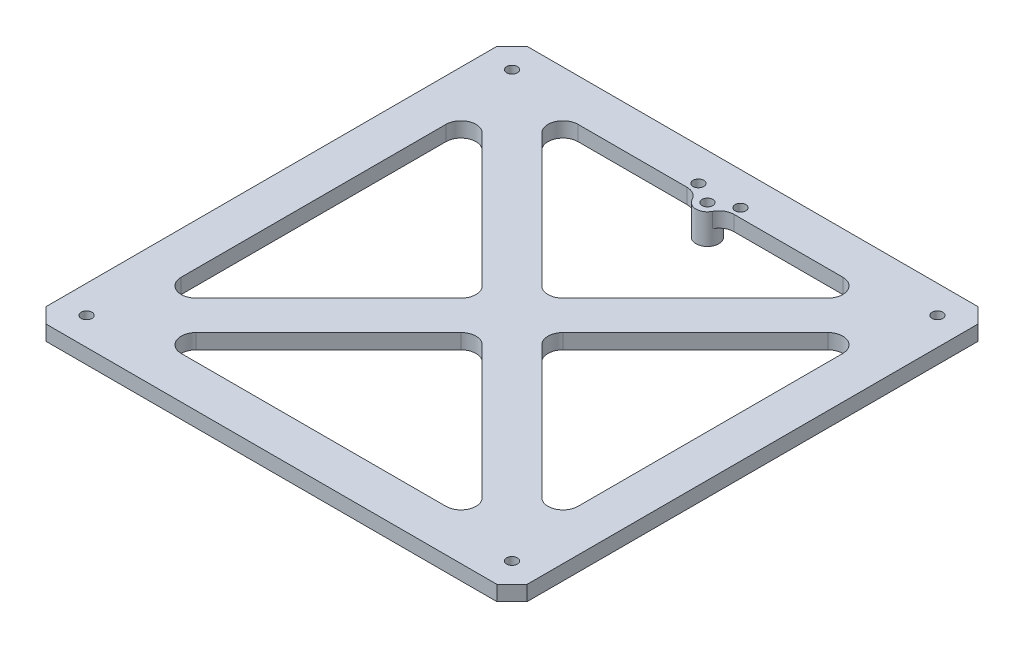
from build123d import *

# Parameters (mm, degrees)
BOSS_EXTRUDE1_DEPTH = 6.35
CUT_EXTRUDE1_DEPTH  = 288.438345563
SKETCH3_R           = 2.286
CUT_EXTRUDE2_DEPTH  = 288.438345563
BOSS_EXTRUDE2_DEPTH = 6.35
SKETCH5_R           = 4.826
BOSS_EXTRUDE3_DEPTH = 6.35
SKETCH6_R           = 2.286
CUT_EXTRUDE3_DEPTH  = 288.648691984


with BuildPart() as part:
    # Sketch1 → Boss-Extrude1 (new body)
    with BuildSketch(Plane(origin=(0, 0, 0), x_dir=(1, 0, 0), z_dir=(0, 1, 0))):
        Polygon((0, 196.85), (6.35, 203.2), (196.85, 203.2), (203.2, 196.85), (203.2, 6.35), (196.85, 0), (6.35, 0), (0, 6.35), align=None)
    extrude(amount=BOSS_EXTRUDE1_DEPTH)

    # Sketch2 → Cut-Extrude1 (cut, through all)
    with BuildSketch(Plane(origin=(0, 6.35, 0), x_dir=(1, 0, 0), z_dir=(0, 1, 0))):
        with BuildLine():
            Line((45.682614691, 185.42), (157.517385309, 185.42))
            ThreePointArc((157.517385309, 185.42), (163.384020341, 181.500039796), (162.00751337, 174.579871939))
            Line((162.00751337, 174.579871939), (106.090128061, 118.66248663))
            ThreePointArc((106.090128061, 118.66248663), (101.6, 116.802614691), (97.109871939, 118.66248663))
            Line((97.109871939, 118.66248663), (41.19248663, 174.579871939))
            ThreePointArc((41.19248663, 174.579871939), (39.815979659, 181.500039796), (45.682614691, 185.42))
        make_face()
        with BuildLine():
            Line((17.78, 157.517385309), (17.78, 45.682614691))
            ThreePointArc((17.78, 45.682614691), (21.699960204, 39.815979659), (28.620128061, 41.19248663))
            Line((28.620128061, 41.19248663), (84.53751337, 97.109871939))
            ThreePointArc((84.53751337, 97.109871939), (86.397385309, 101.6), (84.53751337, 106.090128061))
            Line((84.53751337, 106.090128061), (28.620128061, 162.00751337))
            ThreePointArc((28.620128061, 162.00751337), (21.699960204, 163.384020341), (17.78, 157.517385309))
        make_face()
        with BuildLine():
            Line((45.682614691, 17.78), (157.517385309, 17.78))
            ThreePointArc((157.517385309, 17.78), (163.384020341, 21.699960204), (162.00751337, 28.620128061))
            Line((162.00751337, 28.620128061), (106.090128061, 84.53751337))
            ThreePointArc((106.090128061, 84.53751337), (101.6, 86.397385309), (97.109871939, 84.53751337))
            Line((97.109871939, 84.53751337), (41.19248663, 28.620128061))
            ThreePointArc((41.19248663, 28.620128061), (39.815979659, 21.699960204), (45.682614691, 17.78))
        make_face()
        with BuildLine():
            Line((185.42, 157.517385309), (185.42, 45.682614691))
            ThreePointArc((185.42, 45.682614691), (181.500039796, 39.815979659), (174.579871939, 41.19248663))
            Line((174.579871939, 41.19248663), (118.66248663, 97.109871939))
            ThreePointArc((118.66248663, 97.109871939), (116.802614691, 101.6), (118.66248663, 106.090128061))
            Line((118.66248663, 106.090128061), (174.579871939, 162.00751337))
            ThreePointArc((174.579871939, 162.00751337), (181.500039796, 163.384020341), (185.42, 157.517385309))
        make_face()
    extrude(amount=-CUT_EXTRUDE1_DEPTH, mode=Mode.SUBTRACT)

    # Sketch3 → Cut-Extrude2 (cut, through all)
    with BuildSketch(Plane(origin=(0, 6.35, 0), x_dir=(1, 0, 0), z_dir=(0, 1, 0))):
        with Locations(Location((11.73734, 11.73734, 0), (0, 0, 270))):
            Circle(SKETCH3_R)
        with Locations(Location((191.46266, 11.73734, 0), (0, 0, 270))):
            Circle(SKETCH3_R)
        with Locations(Location((191.46266, 191.46266, 0), (0, 0, 270))):
            Circle(SKETCH3_R)
        with Locations(Location((11.73734, 191.46266, 0), (0, 0, 270))):
            Circle(SKETCH3_R)
    extrude(amount=-CUT_EXTRUDE2_DEPTH, mode=Mode.SUBTRACT)

    # Sketch4 → Boss-Extrude2 (add)
    with BuildSketch(Plane(origin=(0, 6.35, 0), x_dir=(1, 0, 0), z_dir=(0, 1, 0))):
        with BuildLine():
            Line((111.554726315, 185.42), (91.645273685, 185.42))
            ThreePointArc((91.645273685, 185.42), (94.961453031, 184.485298195), (97.301368182, 181.956363636))
            ThreePointArc((97.301368182, 181.956363636), (101.6, 179.324), (105.898631818, 181.956363636))
            ThreePointArc((105.898631818, 181.956363636), (108.238546969, 184.485298195), (111.554726315, 185.42))
        make_face()
    extrude(amount=-BOSS_EXTRUDE2_DEPTH)

    # Sketch5 → Boss-Extrude3 (add)
    with BuildSketch(Plane.XZ):
        with Locations(Location((101.6, -184.15, 0), (0, 0, 152.964308211))):
            Circle(SKETCH5_R)
    extrude(amount=BOSS_EXTRUDE3_DEPTH)

    # Sketch6 → Cut-Extrude3 (cut, through all)
    with BuildSketch(Plane.XZ.offset(6.35)):
        with Locations(Location((101.6, -184.15, 0), (0, 0, 270))):
            Circle(SKETCH6_R)
        with Locations(Location((92.71, -189.23, 0), (0, 0, 270))):
            Circle(SKETCH6_R)
        with Locations(Location((110.49, -189.23, 0), (0, 0, 270))):
            Circle(SKETCH6_R)
    extrude(amount=-CUT_EXTRUDE3_DEPTH, mode=Mode.SUBTRACT)


solid = part.part
